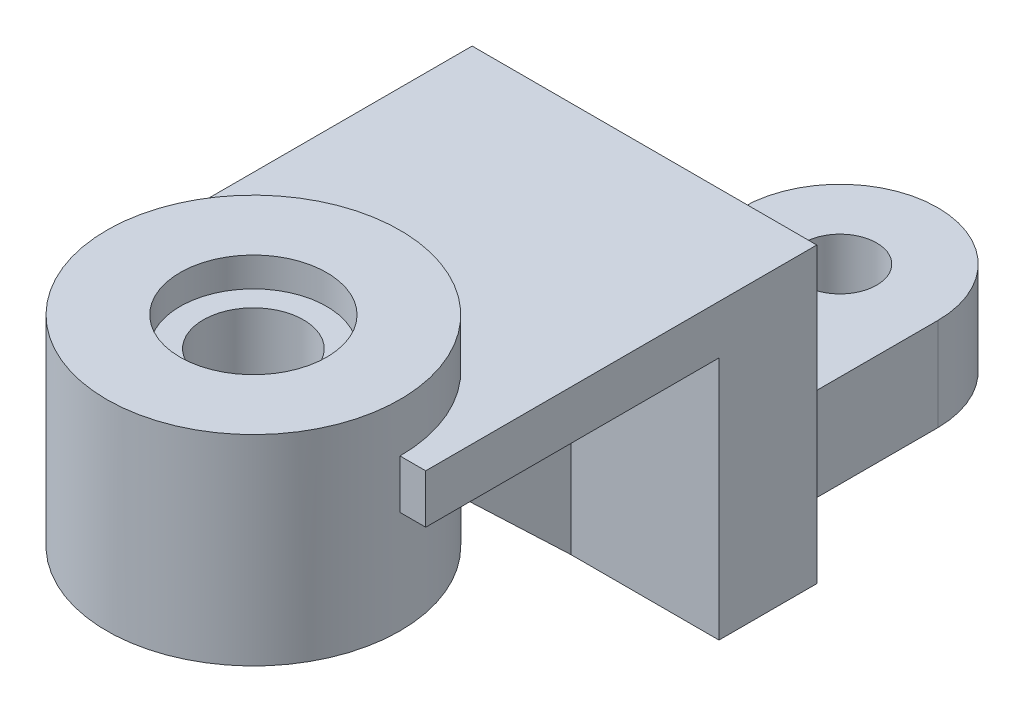
from build123d import *

# Parameters (mm, degrees)
BOSS_EXTRUDE1_DEPTH      = 19
BOSS_EXTRUDE3_DEPTH      = 60
FILLET1_R                = 10
FILLET2_R                = 10
SKETCH4_R                = 7.5
CUT_EXTRUDE1_DEPTH       = 60
SKETCH6_W                = 60
SKETCH6_H                = 10
BOSS_EXTRUDE4_DEPTH      = 70.5
CUT_EXTRUDE2_DEPTH       = 70.5
BOSS_EXTRUDE6_DEPTH      = 10
BOSS_EXTRUDE6_DEPTH_BACK = 31
SKETCH8_R                = 30
SKETCH10_R               = 10.25
CUT_EXTRUDE3_DEPTH       = 41
SKETCH11_R               = 15
CUT_EXTRUDE4_DEPTH       = 6
CUT_EXTRUDE5_START       = -6
SKETCH12_R               = 15
CUT_EXTRUDE5_DEPTH       = 6
SKETCH13_W               = 10
SKETCH13_H               = 30.419601085
BOSS_EXTRUDE7_DEPTH      = 30
BOSS_EXTRUDE8_DEPTH      = 10


with BuildPart() as part:
    # Sketch1 → Boss-Extrude1 (new body)
    with BuildSketch(Plane(origin=(0, 0, 0), x_dir=(1, 0, 0), z_dir=(0, 1, 0))):
        with BuildLine():
            Line((-20, 0), (-20, -40))
            Line((-20, -40), (20, -40))
            Line((20, -40), (20, 0))
            ThreePointArc((20, 0), (0, 20), (-20, 0))
        make_face()
    extrude(amount=BOSS_EXTRUDE1_DEPTH)

    # Sketch3 → Boss-Extrude3 (add)
    with BuildSketch(Plane(origin=(0, 0, 0), x_dir=(1, 0, 0), z_dir=(0, 1, 0))):
        Polygon((0, -40), (35.25, -40), (35.25, -60), (-35.25, -60), (-35.25, -40), align=None)
    extrude(amount=BOSS_EXTRUDE3_DEPTH)

    # Fillet1
    fillet1_edges = [part.edges().sort_by_distance(p)[0] for p in [
        (20, 9.5, 40),
    ]]
    fillet(fillet1_edges, radius=FILLET1_R)

    # Fillet2
    fillet2_edges = [part.edges().sort_by_distance(p)[0] for p in [
        (-20, 9.5, 40),
    ]]
    fillet(fillet2_edges, radius=FILLET2_R)

    # Sketch4 → Cut-Extrude1 (cut)
    with BuildSketch(Plane.XZ):
        with Locations(Location((0, 0, 0), (0, 0, 270))):
            Circle(SKETCH4_R)
    extrude(amount=-CUT_EXTRUDE1_DEPTH, mode=Mode.SUBTRACT)

    # Sketch6 → Boss-Extrude4 (add)
    with BuildSketch(Plane(origin=(35.25, 0, 0), x_dir=(0, 0, -1), z_dir=(1, 0, 0))):
        with Locations((-90, 55)):
            Rectangle(SKETCH6_W, SKETCH6_H)
    extrude(amount=-BOSS_EXTRUDE4_DEPTH)

    # Sketch7 → Cut-Extrude2 (cut)
    with BuildSketch(Plane(origin=(0, 60, 0), x_dir=(1, 0, 0), z_dir=(0, 1, 0))):
        with BuildLine():
            Line((-30, -120), (30, -120))
            ThreePointArc((30, -120), (0, -90), (-30, -120))
        make_face()
    extrude(amount=-CUT_EXTRUDE2_DEPTH, mode=Mode.SUBTRACT)

    # Sketch8 → Boss-Extrude6 (add, two sides: drawn at the far end of the back side and taken through both)
    with BuildSketch(Plane(origin=(0, 60, 0), x_dir=(1, 0, 0), z_dir=(0, 1, 0)).offset(-BOSS_EXTRUDE6_DEPTH_BACK)):
        with Locations(Location((0, -120, 0), (0, 0, 270))):
            Circle(SKETCH8_R)
    extrude(amount=BOSS_EXTRUDE6_DEPTH + BOSS_EXTRUDE6_DEPTH_BACK)

    # Sketch10 → Cut-Extrude3 (cut)
    with BuildSketch(Plane(origin=(0, 70, 0), x_dir=(1, 0, 0), z_dir=(0, 1, 0))):
        with Locations(Location((0, -120, 0), (0, 0, 270))):
            Circle(SKETCH10_R)
    extrude(amount=-CUT_EXTRUDE3_DEPTH, mode=Mode.SUBTRACT)

    # Sketch11 → Cut-Extrude4 (cut)
    with BuildSketch(Plane(origin=(0, 70, 0), x_dir=(1, 0, 0), z_dir=(0, 1, 0))):
        with Locations(Location((0, -120, 0), (0, 0, 270))):
            Circle(SKETCH11_R)
    extrude(amount=-CUT_EXTRUDE4_DEPTH, mode=Mode.SUBTRACT)

    # Sketch12 → Cut-Extrude5 (cut)
    with BuildSketch(Plane.XZ.offset(-29).offset(CUT_EXTRUDE5_START)):
        with Locations(Location((0, 120, 0), (0, 0, 90))):
            Circle(SKETCH12_R)
    extrude(amount=CUT_EXTRUDE5_DEPTH, mode=Mode.SUBTRACT)

    # Sketch13 → Boss-Extrude7 (add)
    with BuildSketch(Plane.XZ.offset(-29)):
        with Locations((0, 75.209800543)):
            Rectangle(SKETCH13_W, SKETCH13_H)
    extrude(amount=-BOSS_EXTRUDE7_DEPTH)

    # Sketch16 → Boss-Extrude8 (add)
    with BuildSketch(Plane(origin=(5, 0, 0), x_dir=(0, 0, -1), z_dir=(1, 0, 0))):
        Polygon((-90.419601085, 29), (-60, 29), (-60, 0), align=None)
    extrude(amount=-BOSS_EXTRUDE8_DEPTH)


solid = part.part
